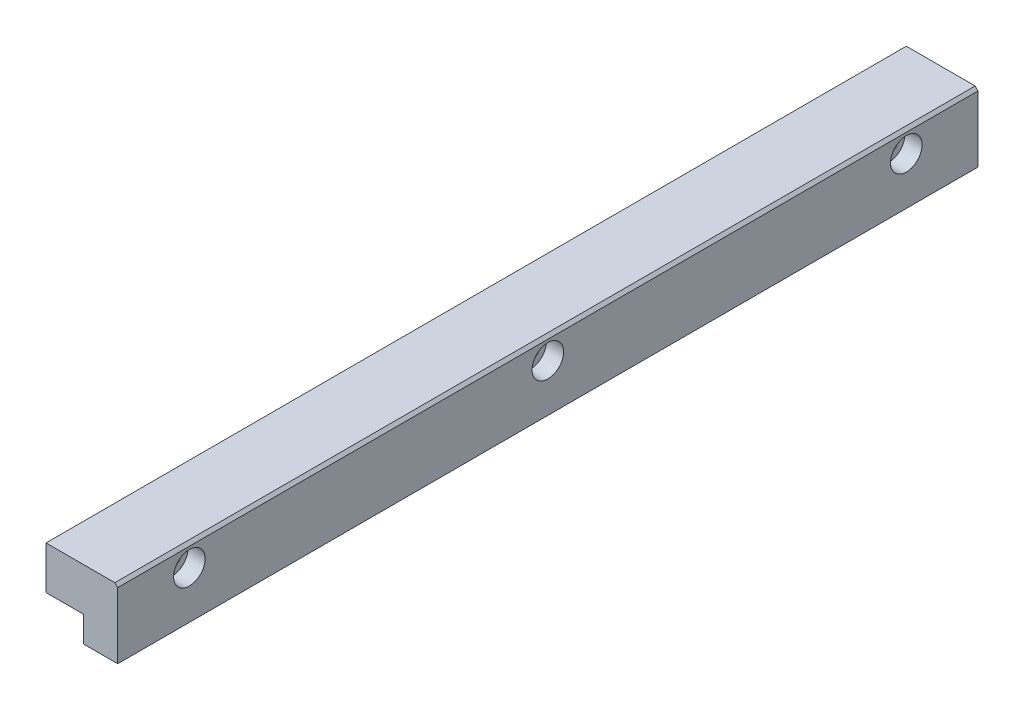
from build123d import *

# Parameters (mm, degrees)
EXTRUDE_1_DEPTH              = 300
HOLE_WIZARD_M6_1_D           = 6.4
HOLE_WIZARD_M6_1_CBORE_D     = 11
HOLE_WIZARD_M6_1_CBORE_DEPTH = 6
CHAMFER_1_SIZE               = 1
CHAMFER_2_SIZE               = 1


with BuildPart() as part:
    # 草图1 → 凸台-拉伸1 (new body)
    with BuildSketch(Plane.XY):
        Polygon((25, 440), (13, 440), (13, 450), (0, 450), (0, 465), (25, 465), align=None)
    extrude(amount=-EXTRUDE_1_DEPTH)

    # M6 凹头盖螺钉的柱形沉头孔1 (through all)
    with Locations(Plane(origin=(25, 0, 0), x_dir=(0, 0, -1), z_dir=(1, 0, 0))):
        with Locations((25, 457.5), (275, 457.5), (150, 457.5)):
            CounterBoreHole(HOLE_WIZARD_M6_1_D / 2, HOLE_WIZARD_M6_1_CBORE_D / 2, HOLE_WIZARD_M6_1_CBORE_DEPTH)

    # 倒角1
    chamfer_1_edges = [part.edges().sort_by_distance(p)[0] for p in [
        (25, 440, -150),
        (19, 440, -300),
        (13, 440, -150),
        (19, 440, 0),
    ]]
    chamfer(chamfer_1_edges, length=CHAMFER_1_SIZE)

    # 倒角2
    chamfer_2_edges = [part.edges().sort_by_distance(p)[0] for p in [
        (25, 465, -150),
    ]]
    chamfer(chamfer_2_edges, length=CHAMFER_2_SIZE)


solid = part.part
